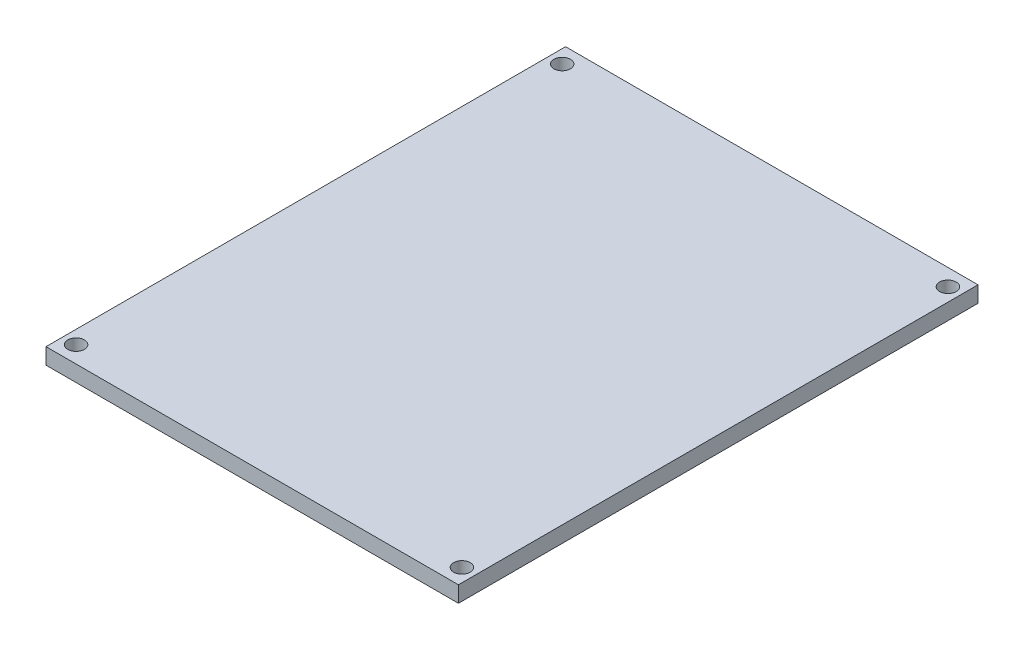
from build123d import *

# Parameters (mm, degrees)
SKETCH1_W           = 77
SKETCH1_H           = 97
SKETCH1_R           = 1.55
BOSS_EXTRUDE1_DEPTH = 3


with BuildPart() as part:
    # Sketch1 → Boss-Extrude1 (new body)
    with BuildSketch(Plane(origin=(0, 0, 0), x_dir=(1, 0, 0), z_dir=(0, 1, 0))):
        with Locations((28.665754391, 42.859827362)):
            Rectangle(SKETCH1_W, SKETCH1_H)
        with Locations(Location((-7.347299641, 88.226921402, 0), (0, 0, 270))):
            Circle(SKETCH1_R, mode=Mode.SUBTRACT)
        with Locations(Location((64.678808423, 88.226921402, 0), (0, 0, 270))):
            Circle(SKETCH1_R, mode=Mode.SUBTRACT)
        with Locations(Location((-7.347299641, -2.507266679, 0), (0, 0, 270))):
            Circle(SKETCH1_R, mode=Mode.SUBTRACT)
        with Locations(Location((64.678808423, -2.507266679, 0), (0, 0, 270))):
            Circle(SKETCH1_R, mode=Mode.SUBTRACT)
    extrude(amount=BOSS_EXTRUDE1_DEPTH)


solid = part.part
